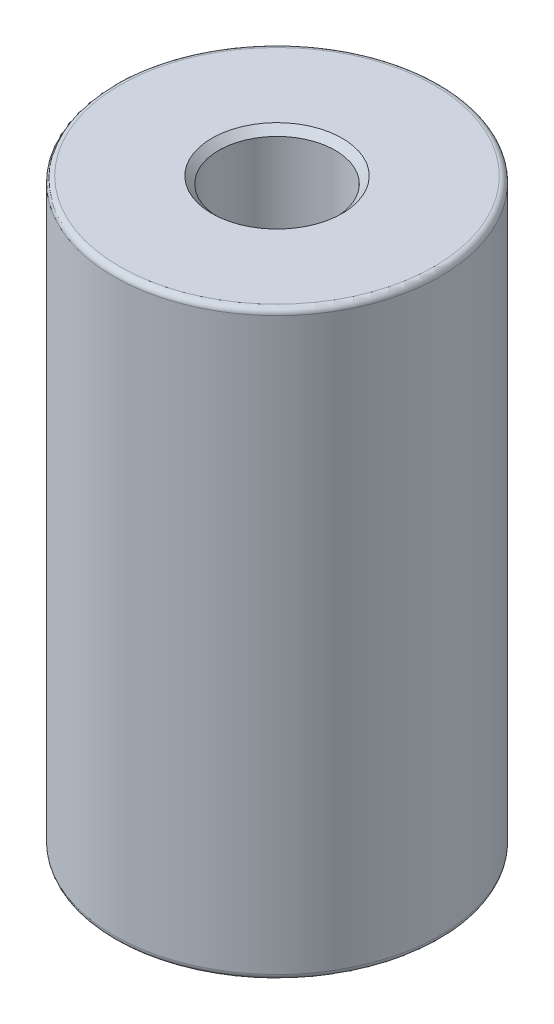
from build123d import *

# Parameters (mm, degrees)
SKETCH_1_R          = 7
EXTRUDE_1_DEPTH     = 25
CUT_EXTRUDE_START   = 25
SKETCH_2_R          = 2.5
CUT_EXTRUDE_1_DEPTH = 10
SKETCH_3_R          = 4
CUT_EXTRUDE_2_DEPTH = 15
FILLET_1_R          = 0.25
CHAMFER_1_SIZE      = 0.3


with BuildPart() as part:
    # 草图1 → 凸台-拉伸1 (new body)
    with BuildSketch(Plane(origin=(0, 0, 0), x_dir=(1, 0, 0), z_dir=(0, 1, 0))):
        with Locations(Location((0, 0, 0), (0, 0, 270))):
            Circle(SKETCH_1_R)
    extrude(amount=EXTRUDE_1_DEPTH)

    # 草图2 → 切除-拉伸1 (cut)
    with BuildSketch(Plane(origin=(0, 0, 0), x_dir=(1, 0, 0), z_dir=(0, 1, 0)).offset(CUT_EXTRUDE_START)):
        with Locations(Location((0, 0, 0), (0, 0, 270))):
            Circle(SKETCH_2_R)
    extrude(amount=-CUT_EXTRUDE_1_DEPTH, mode=Mode.SUBTRACT)

    # 草图3 → 切除-拉伸2 (cut)
    with BuildSketch(Plane(origin=(0, 0, 0), x_dir=(1, 0, 0), z_dir=(0, 1, 0))):
        with Locations(Location((0, 0, 0), (0, 0, 270))):
            Circle(SKETCH_3_R)
    extrude(amount=CUT_EXTRUDE_2_DEPTH, mode=Mode.SUBTRACT)

    # 圆角1
    fillet_1_edges = [part.edges().sort_by_distance(p)[0] for p in [
        (0, 0, -7),
        (0, 25, -7),
    ]]
    fillet(fillet_1_edges, radius=FILLET_1_R)

    # 倒角1
    chamfer_1_edges = [part.edges().sort_by_distance(p)[0] for p in [
        (0, 0, -4),
        (0, 25, -2.5),
    ]]
    chamfer(chamfer_1_edges, length=CHAMFER_1_SIZE)


solid = part.part
